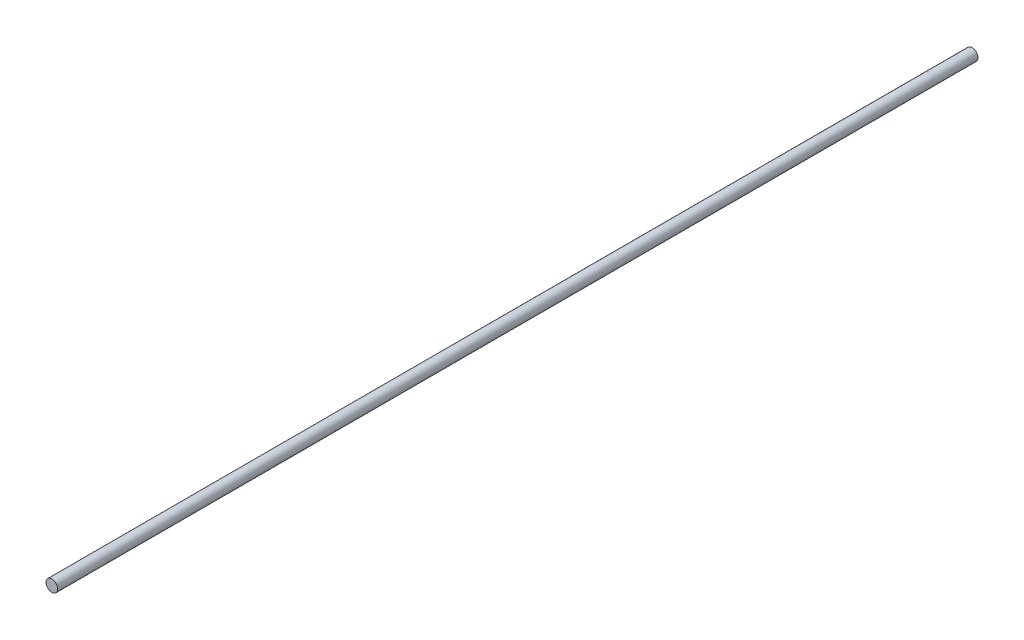
from build123d import *

# Parameters (mm, degrees)
SKIZZE1_R                       = 4
AUFSATZ_LINEAR_AUSTRAGEN1_DEPTH = 630


with BuildPart() as part:
    # Skizze1 → Aufsatz-Linear austragen1 (new body)
    with BuildSketch(Plane.XY):
        Circle(SKIZZE1_R)
    extrude(amount=AUFSATZ_LINEAR_AUSTRAGEN1_DEPTH)


solid = part.part
